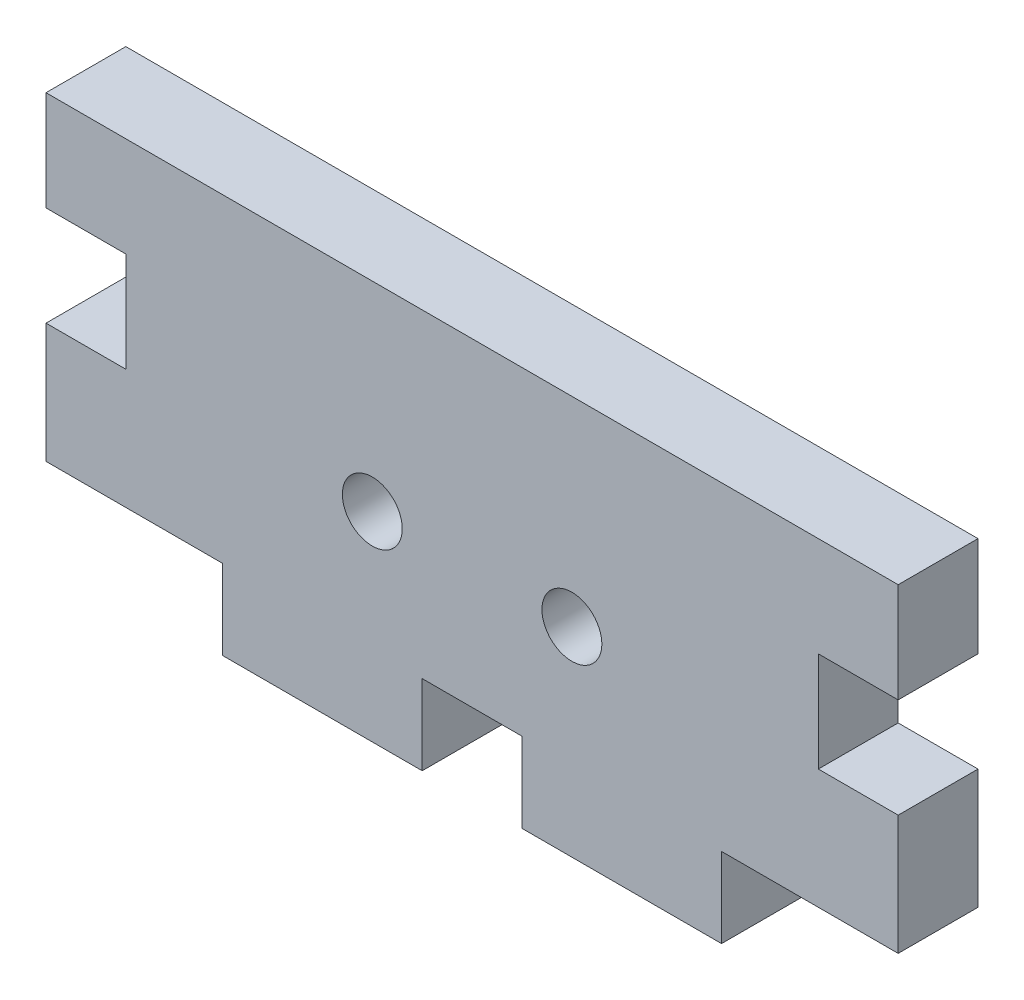
from build123d import *

# Parameters (mm, degrees)
SKETCH_1_W          = 42.7
SKETCH_1_H          = 20
EXTRUDE_1_DEPTH     = 4
SKETCH_2_R          = 1.5
SKETCH_2_W          = 8.85
SKETCH_2_H          = 4
SKETCH_2_W_2        = 5
SKETCH_2_W_3        = 4
SKETCH_2_H_2        = 5
CUT_EXTRUDE_1_DEPTH = 4


with BuildPart() as part:
    # Эскиз1 → Бобышка-Вытянуть1 (new body)
    with BuildSketch(Plane.XY):
        with Locations((21.35, 10)):
            Rectangle(SKETCH_1_W, SKETCH_1_H)
    extrude(amount=EXTRUDE_1_DEPTH)

    # Эскиз2 → Вырез-Вытянуть1 (cut)
    with BuildSketch(Plane.XY.offset(4)):
        with Locations((16.35, 10)):
            Circle(SKETCH_2_R)
        with Locations(Location((26.35, 10, 0), (0, 0, 180))):
            Circle(SKETCH_2_R)
        with Locations((4.425, 2)):
            Rectangle(SKETCH_2_W, SKETCH_2_H)
        with Locations((21.35, 2)):
            Rectangle(SKETCH_2_W_2, SKETCH_2_H)
        with Locations((38.275, 2)):
            Rectangle(SKETCH_2_W, SKETCH_2_H)
        with Locations((2, 12.5)):
            Rectangle(SKETCH_2_W_3, SKETCH_2_H_2)
        with Locations((40.7, 12.5)):
            Rectangle(SKETCH_2_W_3, SKETCH_2_H_2)
    extrude(amount=-CUT_EXTRUDE_1_DEPTH, mode=Mode.SUBTRACT)


solid = part.part
